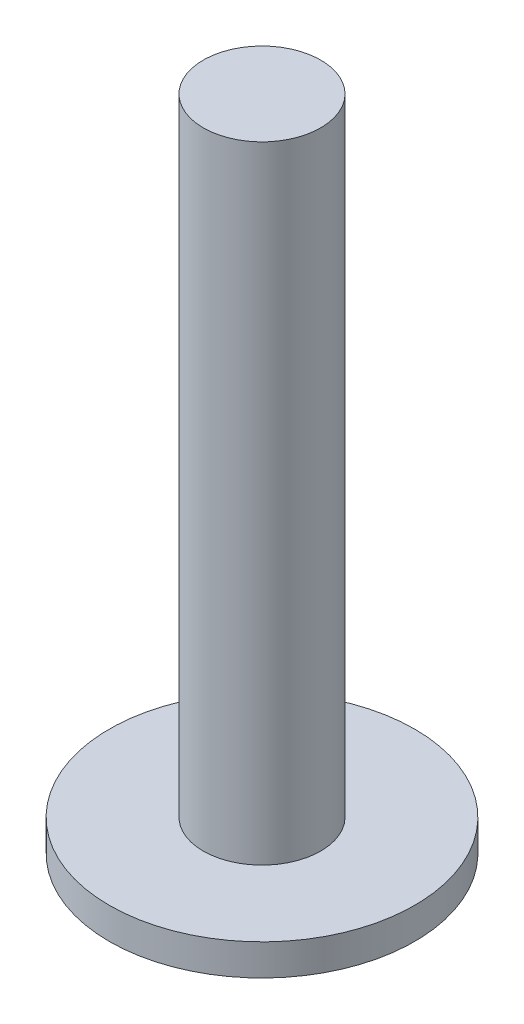
from build123d import *

# Parameters (mm, degrees)
SKETCH_1_R      = 3.9
EXTRUDE_1_DEPTH = 0.8
SKETCH_2_R      = 1.5
EXTRUDE_4_DEPTH = 16


with BuildPart() as part:
    # 草图1 → 凸台-拉伸1 (new body)
    with BuildSketch(Plane(origin=(0, 0, 0), x_dir=(1, 0, 0), z_dir=(0, 1, 0))):
        with Locations(Location((0, 0, 0), (0, 0, 270))):
            Circle(SKETCH_1_R)
        Polygon((-1, 0), (-1, 0.2), (-0.2, 0.2), (-0.2, 1), (0, 1), (0.2, 1), (0.2, 0.2), (1, 0.2), (1, 0), (1, -0.2), (0.2, -0.2), (0.2, -1), (0, -1), (-0.2, -1), (-0.2, -0.2), (-1, -0.2), align=None, mode=Mode.SUBTRACT)
    extrude(amount=EXTRUDE_1_DEPTH)

    # 草图2 → 凸台-拉伸4 (add)
    with BuildSketch(Plane(origin=(0, 0.8, 0), x_dir=(1, 0, 0), z_dir=(0, 1, 0))):
        with Locations(Location((0, 0, 0), (0, 0, 270))):
            Circle(SKETCH_2_R)
    extrude(amount=EXTRUDE_4_DEPTH)


solid = part.part
